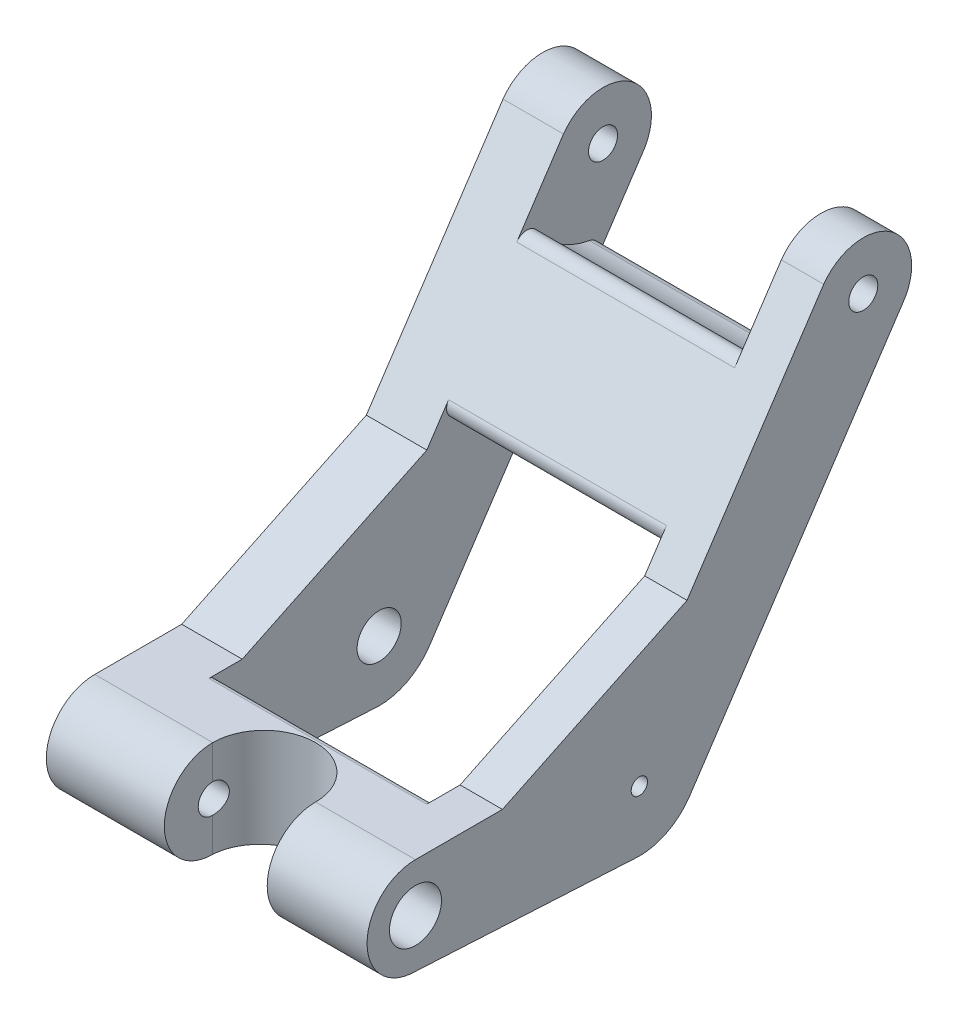
from build123d import *
from build123d.topology import SkipClean

# Parameters (mm, degrees)
SKETCH19_R           = 2.4
SKETCH19_R_2         = 3.65
BASE_DEPTH           = 10
CONNECTOR_DEPTH      = 36
SKETCH21_R           = 2.4
SKETCH21_R_2         = 1.35
THINPLATE_DEPTH      = 7
SPACER_START         = 6
SKETCH22_R           = 3
SKETCH22_R_2         = 1.35
SPACER_DEPTH         = 6
SHOCKHOLE_DEPTH      = 87.821656285
SKETCH25_R           = 2.4
SHOCKSCREWHOLE_DEPTH = 92.836811791
SKETCH26_R           = 4.3
BOLTMOUNT_DEPTH      = 8.6
NUTMOUNT_DEPTH       = 8


with BuildPart() as part:
    # Sketch19 → Base (new body)
    with BuildSketch(Plane(origin=(0, 0, 0), x_dir=(0, 0, -1), z_dir=(1, 0, 0))):
        with BuildLine():
            Line((-37, -8), (0, -10))
            ThreePointArc((0, -10), (4.583911967, -8.887505335), (8.147908412, -5.797550216))
            Line((8.147908412, -5.797550216), (43.51832673, 47.361959827))
            ThreePointArc((43.51832673, 47.361959827), (41.624994171, 58.527589824), (30.463173191, 56.611929669))
            Line((30.463173191, 56.611929669), (7.879284036, 22.669767278))
            Line((7.879284036, 22.669767278), (-22.627449378, 8))
            Line((-22.627449378, 8), (-37, 8))
            ThreePointArc((-37, 8), (-45, 0), (-37, -8))
        make_face()
        with Locations((37, 52)):
            Circle(SKETCH19_R, mode=Mode.SUBTRACT)
        Circle(SKETCH19_R_2, mode=Mode.SUBTRACT)
        with Locations((-37, 0)):
            Circle(SKETCH19_R, mode=Mode.SUBTRACT)
    extrude(amount=BASE_DEPTH)

    # Sketch20 → Connector (add)
    with BuildSketch(Plane(origin=(10, 0, 0), x_dir=(0, 0, -1), z_dir=(1, 0, 0))):
        with BuildLine():
            Line((22.739953466, 45.004417061), (11.476605987, 28.076315503))
            ThreePointArc((11.476605987, 28.076315503), (11.211590252, 26.444347724), (12.265593287, 25.170522865))
            ThreePointArc((12.265593287, 25.170522865), (17.059780993, 22.202789746), (21.162184229, 18.334720032))
            ThreePointArc((21.162184229, 18.334720032), (22.800516777, 17.648363193), (24.338869924, 18.536444744))
            Line((24.338869924, 18.536444744), (36.054780209, 36.144719684))
            ThreePointArc((36.054780209, 36.144719684), (36.228471119, 38.039284164), (34.738265288, 39.22200547))
            ThreePointArc((34.738265288, 39.22200547), (29.8112457, 41.196556117), (26.087002565, 44.97866999))
            ThreePointArc((26.087002565, 44.97866999), (24.420439055, 45.896459743), (22.739953466, 45.004417061))
        make_face()
        with BuildLine():
            Line((-28.142494559, 8), (-37, 8))
            ThreePointArc((-37, 8), (-45, 0), (-37, -8))
            Line((-37, -8), (-28.071624283, -8.482614904))
            ThreePointArc((-28.071624283, -8.482614904), (-27.241263688, -8.114331156), (-27.051523196, -7.22600116))
            ThreePointArc((-27.051523196, -7.22600116), (-27.998959916, -0.241337171), (-27.172063712, 6.75862069))
            ThreePointArc((-27.172063712, 6.75862069), (-27.354655962, 7.615881762), (-28.142494559, 8))
        make_face()
    extrude(amount=CONNECTOR_DEPTH)

    # Sketch21 → ThinPlate (add)
    with BuildSketch(Plane(origin=(46, 0, 0), x_dir=(0, 0, -1), z_dir=(1, 0, 0))):
        with BuildLine():
            Line((-22.627449378, 8), (-28.142494559, 8))
            Line((-28.142494559, 8), (-37, 8))
            ThreePointArc((-37, 8), (-45, 0), (-37, -8))
            Line((-37, -8), (-28.071624283, -8.482614904))
            Line((-28.071624283, -8.482614904), (0, -10))
            ThreePointArc((0, -10), (4.583911967, -8.887505335), (8.147908412, -5.797550216))
            Line((8.147908412, -5.797550216), (24.338869924, 18.536444744))
            Line((24.338869924, 18.536444744), (36.054780209, 36.144719684))
            Line((36.054780209, 36.144719684), (43.51832673, 47.361959827))
            ThreePointArc((43.51832673, 47.361959827), (41.624994171, 58.527589824), (30.463173191, 56.611929669))
            Line((30.463173191, 56.611929669), (22.739953466, 45.004417061))
            Line((22.739953466, 45.004417061), (11.476605987, 28.076315503))
            Line((11.476605987, 28.076315503), (7.879284036, 22.669767278))
            Line((7.879284036, 22.669767278), (-22.627449378, 8))
        make_face()
        with Locations((37, 52)):
            Circle(SKETCH21_R, mode=Mode.SUBTRACT)
        with Locations((-37, 0)):
            Circle(SKETCH21_R, mode=Mode.SUBTRACT)
        Circle(SKETCH21_R_2, mode=Mode.SUBTRACT)
    extrude(amount=THINPLATE_DEPTH)

    # Sketch22 → Spacer (add)
    with SkipClean():  # the faces are left unmerged after this step: merging them gives an invalid solid
        with BuildSketch(Plane.ZY.offset(-46).offset(SPACER_START)):
            with Locations(Location((0, 0, 0), (0, 0, 180))):
                Circle(SKETCH22_R)
            Circle(SKETCH22_R_2, mode=Mode.SUBTRACT)
        extrude(amount=-SPACER_DEPTH)

    # Sketch23 → ShockHole (cut, through all)
    with SkipClean():  # the faces are left unmerged after this step: merging them gives an invalid solid
        with BuildSketch(Plane(origin=(0, 8, 0), x_dir=(1, 0, 0), z_dir=(0, 1, 0))):
            with BuildLine():
                Line((19.5, -37), (19.5, -45.5))
                Line((19.5, -45.5), (36.5, -45.5))
                Line((36.5, -45.5), (36.5, -37))
                ThreePointArc((36.5, -37), (28, -28.5), (19.5, -37))
            make_face()
        extrude(amount=-SHOCKHOLE_DEPTH, mode=Mode.SUBTRACT)

    # Sketch25 → ShockScrewHole (cut, through all)
    with BuildSketch(Plane.ZY):
        with Locations(Location((37, 0, 0), (0, 0, 90))):
            Circle(SKETCH25_R)
    extrude(amount=-SHOCKSCREWHOLE_DEPTH, mode=Mode.SUBTRACT)

    # Sketch26 → BoltMount (cut)
    with SkipClean():  # the faces are left unmerged after this step: merging them gives an invalid solid
        with BuildSketch(Plane(origin=(53, 0, 0), x_dir=(0, 0, -1), z_dir=(1, 0, 0))):
            with Locations((-37, 0)):
                Circle(SKETCH26_R)
        extrude(amount=-BOLTMOUNT_DEPTH, mode=Mode.SUBTRACT)

    # Sketch27 → NutMount (cut)
    with SkipClean():  # the faces are left unmerged after this step: merging them gives an invalid solid
        with BuildSketch(Plane.ZY):
            Polygon((37, -4.387862046), (40.8, -2.193931023), (40.8, 2.193931023), (37, 4.387862046), (33.2, 2.193931023), (33.2, -2.193931023), align=None)
        extrude(amount=-NUTMOUNT_DEPTH, mode=Mode.SUBTRACT)


solid = part.part
